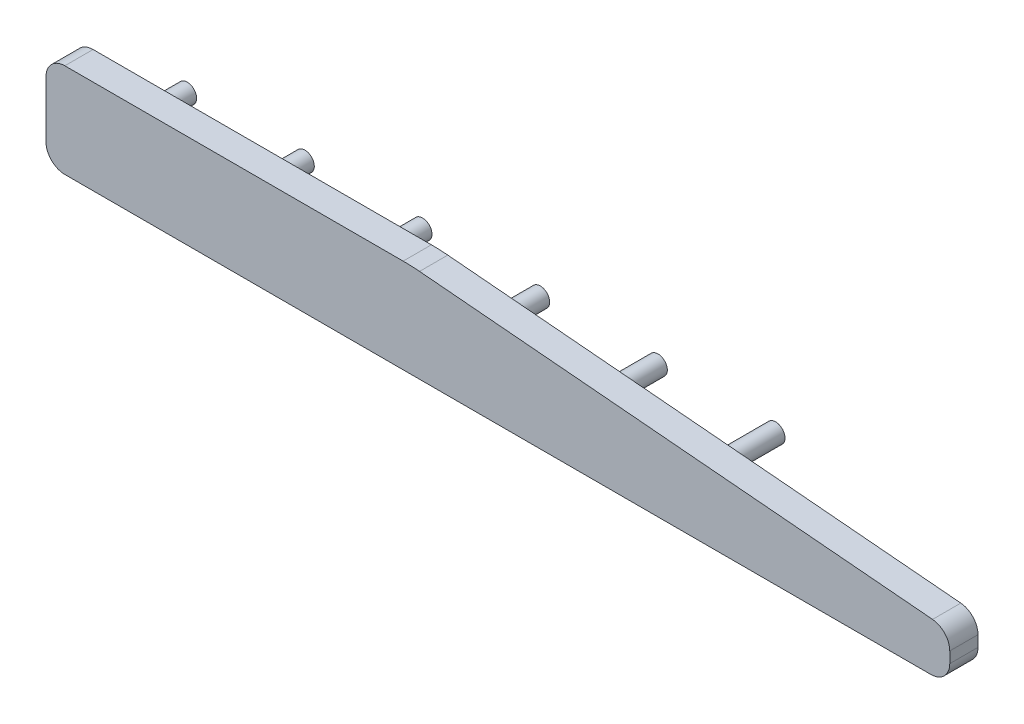
from build123d import *

# Parameters (mm, degrees)
BOSS_EXTRUDE1_DEPTH = 76.2
SKETCH2_R           = 25.4
BOSS_EXTRUDE2_DEPTH = 152.4
LPATTERN1_COUNT     = 6
LPATTERN1_PITCH     = 317.5


with BuildPart() as part:
    # Sketch1 → Boss-Extrude1 (new body)
    with BuildSketch(Plane.XY):
        with BuildLine():
            Line((-50.8, 0), (-2387.6, 0))
            ThreePointArc((-2387.6, 0), (-2423.521024484, 14.878975516), (-2438.4, 50.8))
            Line((-2438.4, 50.8), (-2438.4, 203.2))
            ThreePointArc((-2438.4, 203.2), (-2423.521024484, 239.121024484), (-2387.6, 254))
            Line((-2387.6, 254), (-1474.790405971, 254))
            ThreePointArc((-1474.790405971, 254), (-1452.64706645, 253.517164749), (-1430.545819782, 252.06957683))
            Line((-1430.545819782, 252.06957683), (-46.375541381, 131.054514896))
            ThreePointArc((-46.375541381, 131.054514896), (-13.34734657, 114.768669536), (0, 80.447557213))
            Line((0, 80.447557213), (0, 50.8))
            ThreePointArc((0, 50.8), (-14.878975516, 14.878975516), (-50.8, 0))
        make_face()
    extrude(amount=BOSS_EXTRUDE1_DEPTH)

    # Sketch2 → Boss-Extrude2 (add)
    with BuildSketch(Plane(origin=(0, 0, 0), x_dir=(-1, 0, 0), z_dir=(0, 0, -1))):
        with Locations(Location((2286, 127, 0), (0, 0, 180))):
            Circle(SKETCH2_R)
    boss_extrude2 = extrude(amount=BOSS_EXTRUDE2_DEPTH)

    # LPattern1: Boss-Extrude2 ×6
    with Locations(*[(i * LPATTERN1_PITCH, 0, 0) for i in range(1, LPATTERN1_COUNT)]):
        add(boss_extrude2)


solid = part.part
